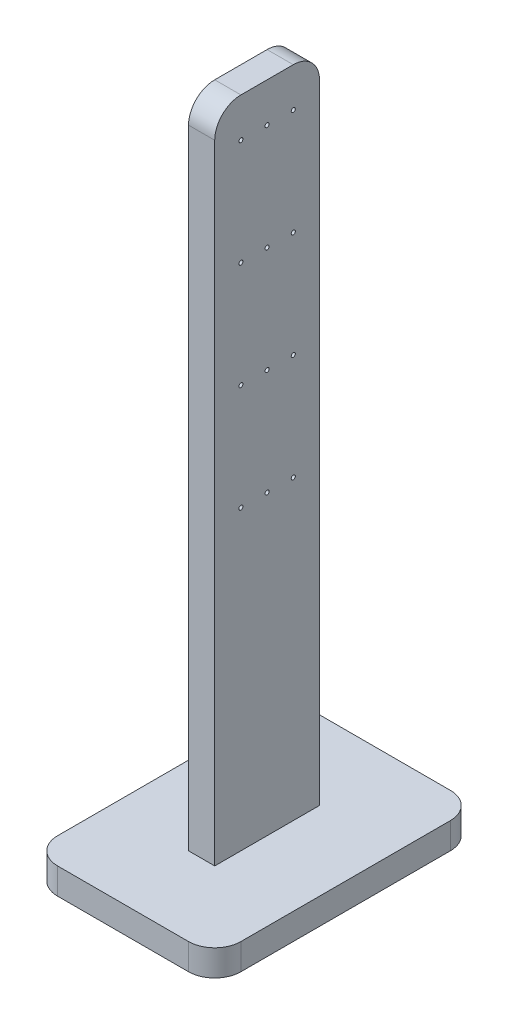
from build123d import *

# Parameters (mm, degrees)
SKETCH_1_R      = 0.7835
EXTRUDE_1_DEPTH = 10
EXTRUDE_2_DEPTH = 10


with BuildPart() as part:
    # 草图1 → 凸台-拉伸1 (new body)
    with BuildSketch(Plane(origin=(0, 0, 0), x_dir=(0, 0, -1), z_dir=(1, 0, 0))):
        with BuildLine():
            Line((0, 0), (40, 0))
            Line((40, 0), (40, 240))
            ThreePointArc((40, 240), (37.071067812, 247.071067812), (30, 250))
            Line((30, 250), (10, 250))
            ThreePointArc((10, 250), (2.928932188, 247.071067812), (0, 240))
            Line((0, 240), (0, 0))
        make_face()
        with Locations((10, 235)):
            Circle(SKETCH_1_R, mode=Mode.SUBTRACT)
        with Locations((20, 235)):
            Circle(SKETCH_1_R, mode=Mode.SUBTRACT)
        with Locations((30, 235)):
            Circle(SKETCH_1_R, mode=Mode.SUBTRACT)
        with Locations((10, 194.5)):
            Circle(SKETCH_1_R, mode=Mode.SUBTRACT)
        with Locations((20, 194.5)):
            Circle(SKETCH_1_R, mode=Mode.SUBTRACT)
        with Locations((30, 194.5)):
            Circle(SKETCH_1_R, mode=Mode.SUBTRACT)
        with Locations((10, 154)):
            Circle(SKETCH_1_R, mode=Mode.SUBTRACT)
        with Locations((20, 154)):
            Circle(SKETCH_1_R, mode=Mode.SUBTRACT)
        with Locations((30, 154)):
            Circle(SKETCH_1_R, mode=Mode.SUBTRACT)
        with Locations((10, 113.5)):
            Circle(SKETCH_1_R, mode=Mode.SUBTRACT)
        with Locations((20, 113.5)):
            Circle(SKETCH_1_R, mode=Mode.SUBTRACT)
        with Locations((30, 113.5)):
            Circle(SKETCH_1_R, mode=Mode.SUBTRACT)
    extrude(amount=EXTRUDE_1_DEPTH)

    # 草图2 → 凸台-拉伸2 (add)
    with BuildSketch(Plane.XZ):
        with BuildLine():
            Line((-20, 30), (30, 30))
            ThreePointArc((30, 30), (37.071067812, 27.071067812), (40, 20))
            Line((40, 20), (40, -60))
            ThreePointArc((40, -60), (37.071067812, -67.071067812), (30, -70))
            Line((30, -70), (-20, -70))
            ThreePointArc((-20, -70), (-27.071067812, -67.071067812), (-30, -60))
            Line((-30, -60), (-30, 20))
            ThreePointArc((-30, 20), (-27.071067812, 27.071067812), (-20, 30))
        make_face()
    extrude(amount=EXTRUDE_2_DEPTH)


solid = part.part
